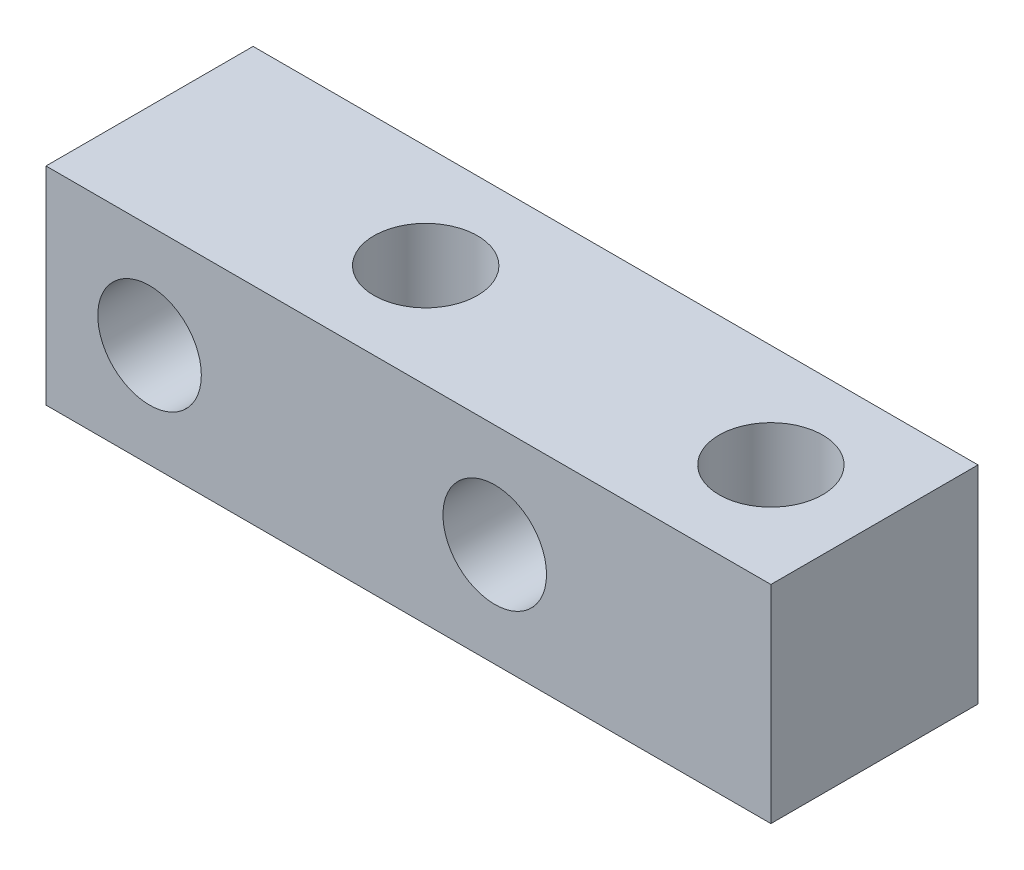
from build123d import *

# Parameters (mm, degrees)
SKETCH_1_W          = 21
SKETCH_1_H          = 6
SKETCH_1_R          = 1.5
EXTRUDE_1_DEPTH     = 6
SKETCH_2_R          = 1.5
CUT_EXTRUDE_1_DEPTH = 8


with BuildPart() as part:
    # 草图1 → 凸台-拉伸1 (new body)
    with BuildSketch(Plane.XY):
        Rectangle(SKETCH_1_W, SKETCH_1_H)
        with Locations((-7.5, 0)):
            Circle(SKETCH_1_R, mode=Mode.SUBTRACT)
        with Locations((2.5, 0)):
            Circle(SKETCH_1_R, mode=Mode.SUBTRACT)
    extrude(amount=EXTRUDE_1_DEPTH)

    # 草图2 → 切除-拉伸1 (cut)
    with BuildSketch(Plane(origin=(0, 3, 0), x_dir=(1, 0, 0), z_dir=(0, 1, 0))):
        with Locations(Location((7.5, -3, 0), (0, 0, 270))):
            Circle(SKETCH_2_R)
        with Locations(Location((-2.5, -3, 0), (0, 0, 270))):
            Circle(SKETCH_2_R)
    extrude(amount=-CUT_EXTRUDE_1_DEPTH, mode=Mode.SUBTRACT)


solid = part.part
